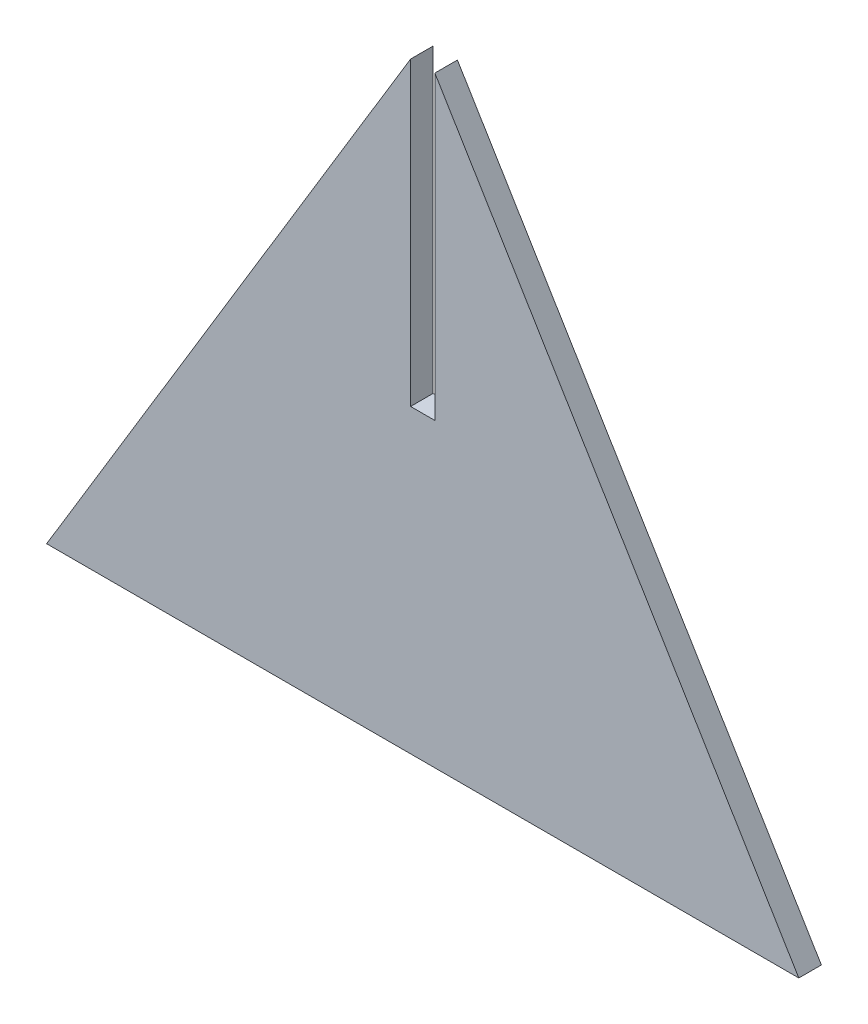
from build123d import *

# Parameters (mm, degrees)
SALIENTE_EXTRUIR1_DEPTH = 3


with BuildPart() as part:
    # Croquis1 → Saliente-Extruir1 (new body)
    with BuildSketch(Plane.XY):
        Polygon((-5.102919442, 80), (-53.490016216, 0), (-1.87711299, 0), (46.509983784, 0), (-1.87711299, 80), (-1.87711299, 40), (-5.102919442, 40), align=None)
    extrude(amount=SALIENTE_EXTRUIR1_DEPTH)


solid = part.part
